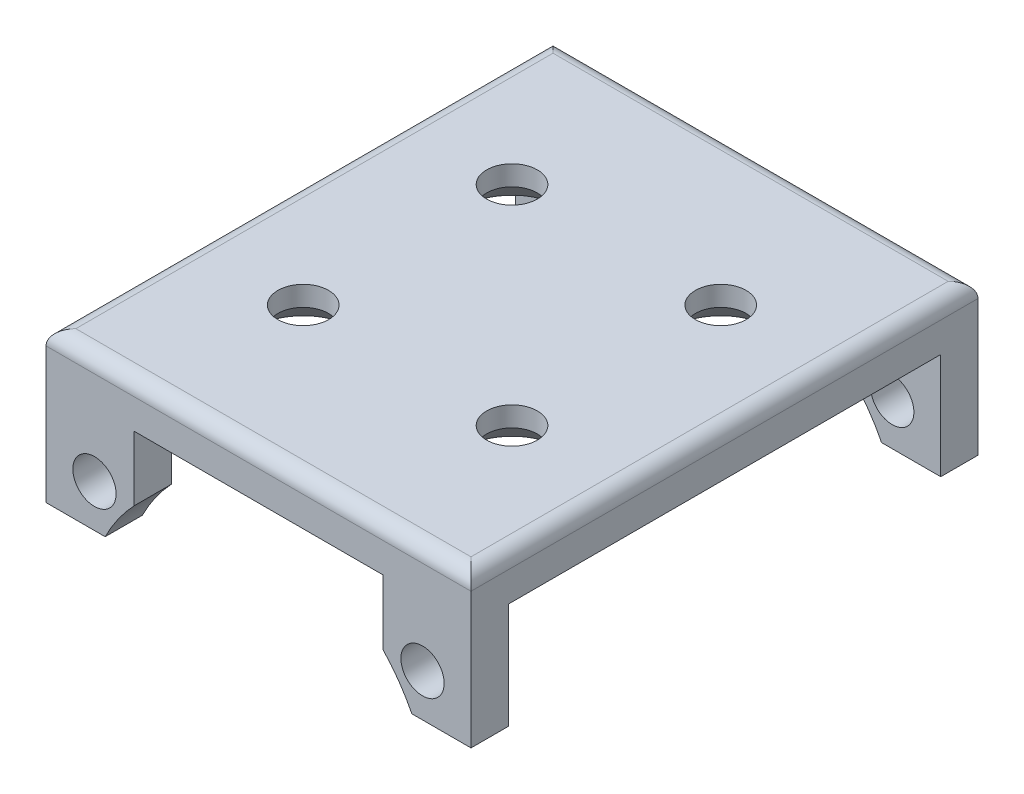
from build123d import *

# Parameters (mm, degrees)
BOSS_EXTRUDE7_DEPTH                            = 17
BOSS_EXTRUDE7_DEPTH_BACK                       = 17
SKETCH1_R                                      = 1.45
SKETCH34_W                                     = 28.4
SKETCH34_H                                     = 7.5
CUT_EXTRUDE11_DEPTH                            = 37.521397837
SKETCH35_R                                     = 5
CUT_EXTRUDE12_DEPTH                            = 25.542055741
CSK_FOR_M3_HEX_SOCKET_COUNTERSUNK_CA_2_COUNT   = 2
CSK_FOR_M3_HEX_SOCKET_COUNTERSUNK_CA_2_PITCH   = 16.5
CSK_FOR_M3_HEX_SOCKET_COUNTERSUNK_CA_3_COUNT   = 2
CSK_FOR_M3_HEX_SOCKET_COUNTERSUNK_CA_3_PITCH   = 18
CSK_FOR_M3_HEX_SOCKET_COUNTERSUNK_CA_4_COUNT   = 2
CSK_FOR_M3_HEX_SOCKET_COUNTERSUNK_CA_4_PITCH   = 24.418230894
FILLET5_R                                      = 1
SKETCH41_W                                     = 28.5
SKETCH41_H                                     = 0.4
CUT_EXTRUDE13_DEPTH                            = 40.895175147
SKETCH47_W                                     = 24
SKETCH47_H                                     = 28
BOSS_EXTRUDE8_DEPTH                            = 3
CSK_FOR_M3_HEX_SOCKET_COUNTERSUNK_CA_5_A_COUNT = 2
CSK_FOR_M3_HEX_SOCKET_COUNTERSUNK_CA_5_A_PITCH = 9.899494937
CSK_FOR_M3_HEX_SOCKET_COUNTERSUNK_CA_6_COUNT   = 2
CSK_FOR_M3_HEX_SOCKET_COUNTERSUNK_CA_6_PITCH   = 9.899494937
CSK_FOR_M3_HEX_SOCKET_COUNTERSUNK_CA_7_COUNT   = 2
CSK_FOR_M3_HEX_SOCKET_COUNTERSUNK_CA_7_PITCH   = 9.899494937
CSK_FOR_M3_HEX_SOCKET_COUNTERSUNK_CA_8_COUNT   = 2
CSK_FOR_M3_HEX_SOCKET_COUNTERSUNK_CA_8_PITCH   = 9.899494937
SKETCH51_W                                     = 8.04998649
SKETCH51_H                                     = 7.642392238
BOSS_EXTRUDE9_DEPTH                            = 3
SKETCH53_W                                     = 29
SKETCH53_H                                     = 7.1
CUT_EXTRUDE14_DEPTH                            = 37.521397837
SKETCH54_W                                     = 16.7
SKETCH54_H                                     = 5.548131356
CUT_EXTRUDE15_DEPTH                            = 40.895175147


with BuildPart() as part:
    # Sketch1 → Boss-Extrude7 (new, two sides: drawn at the far end of the back side and taken through both)
    with BuildSketch(Plane.XY.offset(-BOSS_EXTRUDE7_DEPTH_BACK)):
        with BuildLine():
            Line((-14.25, 15.25), (-14.25, 4.75))
            Line((-14.25, 4.75), (-10.473180033, 4.75))
            ThreePointArc((-10.473180033, 4.75), (-9.502581542, 6.476954843), (-8.25, 8.011710179))
            Line((-8.25, 8.011710179), (-8.25, 12.25))
            Line((-8.25, 12.25), (8.25, 12.25))
            Line((8.25, 12.25), (8.25, 8.011710179))
            ThreePointArc((8.25, 8.011710179), (9.502581542, 6.476954843), (10.473180033, 4.75))
            Line((10.473180033, 4.75), (14.25, 4.75))
            Line((14.25, 4.75), (14.25, 15.25))
            Line((14.25, 15.25), (-14.25, 15.25))
        make_face()
        with Locations((11, 8)):
            Circle(SKETCH1_R, mode=Mode.SUBTRACT)
        with Locations((-11, 8)):
            Circle(SKETCH1_R, mode=Mode.SUBTRACT)
    extrude(amount=BOSS_EXTRUDE7_DEPTH + BOSS_EXTRUDE7_DEPTH_BACK)

    # Sketch34 → Cut-Extrude11 (cut, through all)
    with BuildSketch(Plane.ZY.offset(14.25)):
        with Locations((0, 8.5)):
            Rectangle(SKETCH34_W, SKETCH34_H)
    extrude(amount=-CUT_EXTRUDE11_DEPTH, mode=Mode.SUBTRACT)

    # Sketch35 → Cut-Extrude12 (cut, through all)
    with BuildSketch(Plane(origin=(0, 15.25, 0), x_dir=(1, 0, 0), z_dir=(0, 1, 0))):
        Circle(SKETCH35_R)
    extrude(amount=-CUT_EXTRUDE12_DEPTH, mode=Mode.SUBTRACT)

    # Sketch40 → CSK for M3 Hex Socket Countersunk Cap Sc (revolve, cut)
    with BuildSketch(Plane(origin=(-8.25, 12.25, 9), x_dir=(0, 0, -1), z_dir=(1, 0, 0))):
        Polygon((0, 0), (0, 3), (1.7, 3), (1.7, 1.66), (3.36, 0), align=None)
    csk_for_m3_hex_socket_countersunk_cap_sc = revolve(axis=Axis((-8.25, 5.9, 9), (0, 1, 0)), mode=Mode.SUBTRACT)

    # CSK for M3 Hex Socket Countersunk Ca 2: CSK for M3 Hex Socket Countersunk Cap Sc ×2
    with Locations(*[(i * CSK_FOR_M3_HEX_SOCKET_COUNTERSUNK_CA_2_PITCH, 0, 0) for i in range(1, CSK_FOR_M3_HEX_SOCKET_COUNTERSUNK_CA_2_COUNT)]):
        add(csk_for_m3_hex_socket_countersunk_cap_sc, mode=Mode.SUBTRACT)

    # CSK for M3 Hex Socket Countersunk Ca 3: CSK for M3 Hex Socket Countersunk Cap Sc ×2
    with Locations(*[(0, 0, -i * CSK_FOR_M3_HEX_SOCKET_COUNTERSUNK_CA_3_PITCH) for i in range(1, CSK_FOR_M3_HEX_SOCKET_COUNTERSUNK_CA_3_COUNT)]):
        add(csk_for_m3_hex_socket_countersunk_cap_sc, mode=Mode.SUBTRACT)

    # CSK for M3 Hex Socket Countersunk Ca 4: CSK for M3 Hex Socket Countersunk Cap Sc ×2
    with Locations(*[Vector(0.6757246285173466, 0, -0.7371541402007413) * (i * CSK_FOR_M3_HEX_SOCKET_COUNTERSUNK_CA_4_PITCH) for i in range(1, CSK_FOR_M3_HEX_SOCKET_COUNTERSUNK_CA_4_COUNT)]):
        add(csk_for_m3_hex_socket_countersunk_cap_sc, mode=Mode.SUBTRACT)

    # Fillet5
    fillet5_edges = [part.edges().sort_by_distance(p)[0] for p in [
        (14.25, 15.25, 0),
        (-14.25, 15.25, 0),
        (0, 15.25, -17),
        (0, 15.25, 17),
    ]]
    fillet(fillet5_edges, radius=FILLET5_R)

    # Sketch41 → Cut-Extrude13 (cut, through all)
    with BuildSketch(Plane.XY.offset(17)):
        with Locations((0, 4.95)):
            Rectangle(SKETCH41_W, SKETCH41_H)
    extrude(amount=-CUT_EXTRUDE13_DEPTH, mode=Mode.SUBTRACT)

    # Sketch47 → Boss-Extrude8 (add)
    with BuildSketch(Plane(origin=(0, 15.25, 0), x_dir=(1, 0, 0), z_dir=(0, 1, 0))):
        Rectangle(SKETCH47_W, SKETCH47_H)
    extrude(amount=-BOSS_EXTRUDE8_DEPTH)

    # Sketch50 → CSK for M3 Hex Socket Countersunk Ca 5 (revolve, cut)
    with BuildSketch(Plane(origin=(0, 12.25, 0), x_dir=(0, 0, -1), z_dir=(1, 0, 0))):
        Polygon((0, 0), (0, 3), (1.7, 3), (1.7, 1.66), (3.36, 0), align=None)
    csk_for_m3_hex_socket_countersunk_ca_5 = revolve(axis=Axis((0, 5.9, 0), (0, 1, 0)), mode=Mode.SUBTRACT)

    # CSK for M3 Hex Socket Countersunk Ca 5 a: CSK for M3 Hex Socket Countersunk Ca 5 ×2
    with Locations(*[Vector(-0.7071067811865477, 0, 0.7071067811865474) * (i * CSK_FOR_M3_HEX_SOCKET_COUNTERSUNK_CA_5_A_PITCH) for i in range(1, CSK_FOR_M3_HEX_SOCKET_COUNTERSUNK_CA_5_A_COUNT)]):
        add(csk_for_m3_hex_socket_countersunk_ca_5, mode=Mode.SUBTRACT)

    # CSK for M3 Hex Socket Countersunk Ca 6: CSK for M3 Hex Socket Countersunk Ca 5 ×2
    with Locations(*[Vector(-0.70710678118654, 0, -0.707106781186555) * (i * CSK_FOR_M3_HEX_SOCKET_COUNTERSUNK_CA_6_PITCH) for i in range(1, CSK_FOR_M3_HEX_SOCKET_COUNTERSUNK_CA_6_COUNT)]):
        add(csk_for_m3_hex_socket_countersunk_ca_5, mode=Mode.SUBTRACT)

    # CSK for M3 Hex Socket Countersunk Ca 7: CSK for M3 Hex Socket Countersunk Ca 5 ×2
    with Locations(*[Vector(0.7071067811865548, 0, -0.7071067811865404) * (i * CSK_FOR_M3_HEX_SOCKET_COUNTERSUNK_CA_7_PITCH) for i in range(1, CSK_FOR_M3_HEX_SOCKET_COUNTERSUNK_CA_7_COUNT)]):
        add(csk_for_m3_hex_socket_countersunk_ca_5, mode=Mode.SUBTRACT)

    # CSK for M3 Hex Socket Countersunk Ca 8: CSK for M3 Hex Socket Countersunk Ca 5 ×2
    with Locations(*[Vector(0.7071067811865477, 0, 0.7071067811865474) * (i * CSK_FOR_M3_HEX_SOCKET_COUNTERSUNK_CA_8_PITCH) for i in range(1, CSK_FOR_M3_HEX_SOCKET_COUNTERSUNK_CA_8_COUNT)]):
        add(csk_for_m3_hex_socket_countersunk_ca_5, mode=Mode.SUBTRACT)

    # Sketch51 → Boss-Extrude9 (add)
    with BuildSketch(Plane.XZ.offset(-12.25)):
        Rectangle(SKETCH51_W, SKETCH51_H)
    extrude(amount=-BOSS_EXTRUDE9_DEPTH)

    # Sketch53 → Cut-Extrude14 (cut, through all)
    with BuildSketch(Plane.ZY.offset(14.25)):
        with Locations((0, 8.7)):
            Rectangle(SKETCH53_W, SKETCH53_H)
    extrude(amount=-CUT_EXTRUDE14_DEPTH, mode=Mode.SUBTRACT)

    # Sketch54 → Cut-Extrude15 (cut, through all)
    with BuildSketch(Plane.XY.offset(17)):
        with Locations((0, 9.475934322)):
            Rectangle(SKETCH54_W, SKETCH54_H)
    extrude(amount=-CUT_EXTRUDE15_DEPTH, mode=Mode.SUBTRACT)


solid = part.part
